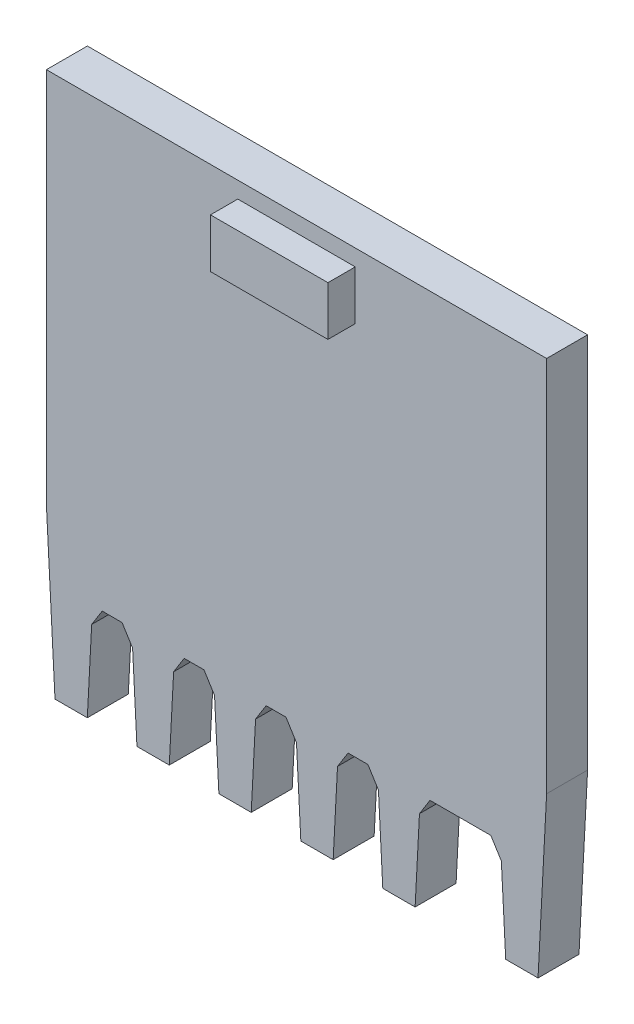
from build123d import *

# Parameters (mm, degrees)
BOSS_EXTRUDE1_DEPTH = 1.5
BOSS_EXTRUDE3_START = 1.5
SKETCH11_W          = 4.3
SKETCH11_H          = 1.8
BOSS_EXTRUDE3_DEPTH = 1


with BuildPart() as part:
    # Sketch1 → Boss-Extrude1 (new body)
    with BuildSketch(Plane.XY):
        Polygon((0, 6), (0.314446676, 0), (1.497941481, 0), (1.657221927, 3.039251967), (2.042586863, 3.65596478), (2.769801294, 3.65596478), (3.155166229, 3.039251967), (3.314446676, 0), (4.497941481, 0), (4.657221927, 3.039251967), (5.042586863, 3.65596478), (5.769801294, 3.65596478), (6.155166229, 3.039251967), (6.314446676, 0), (7.497941481, 0), (7.657221927, 3.039251967), (8.042586863, 3.65596478), (8.769801294, 3.65596478), (9.155166229, 3.039251967), (9.314446676, 0), (10.497941481, 0), (10.657221927, 3.039251967), (11.042586863, 3.65596478), (11.769801294, 3.65596478), (12.155166229, 3.039251967), (12.314446676, 0), (13.497941481, 0), (13.657221927, 3.039251967), (14.042586863, 3.65596478), (16.269801294, 3.65596478), (16.655166229, 3.039251967), (16.814446676, 0), (17.997941481, 0), (18.312388157, 6), (18.312388157, 19.8), (0, 19.8), align=None)
    extrude(amount=BOSS_EXTRUDE1_DEPTH)

    # Sketch11 → Boss-Extrude3 (add)
    with BuildSketch(Plane.XY.offset(BOSS_EXTRUDE3_START)):
        with Locations((9.156194078, 18.3)):
            Rectangle(SKETCH11_W, SKETCH11_H)
    extrude(amount=BOSS_EXTRUDE3_DEPTH)


solid = part.part
